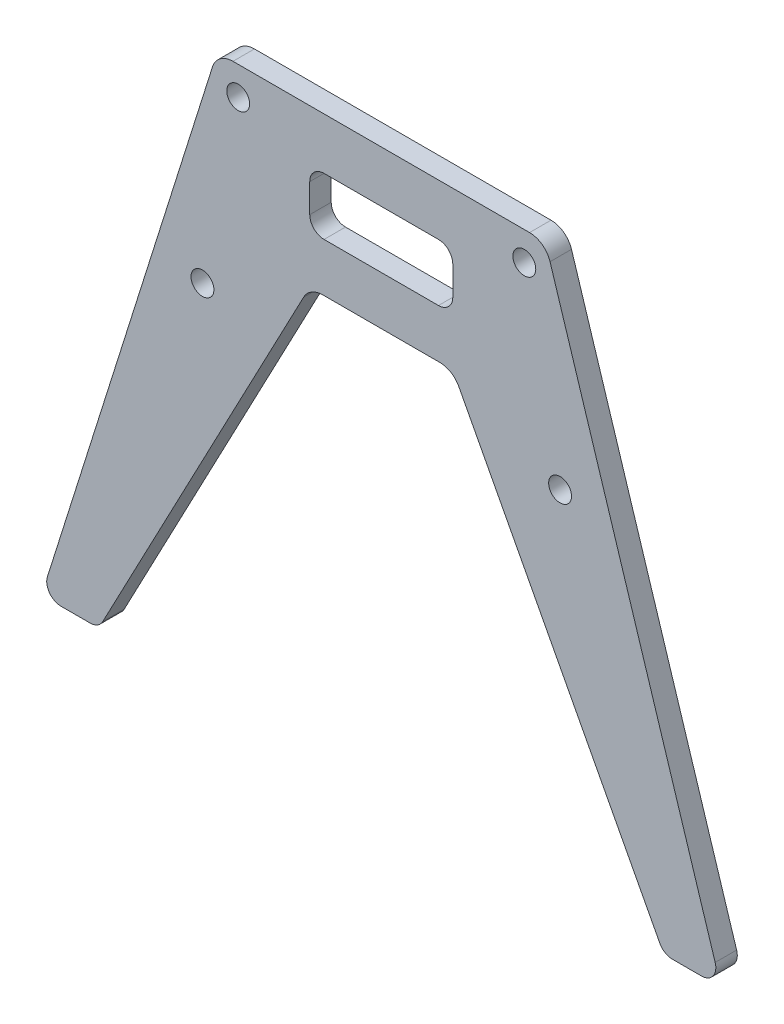
from build123d import *

# Parameters (mm, degrees)
SKETCH_2_R          = 1.6
EXTRUDE_1_DEPTH     = 3
FILLET_1_R          = 3
FILLET_2_R          = 2
FILLET_3_R          = 3
SKETCH_4_W          = 20
SKETCH_4_H          = 8
CUT_EXTRUDE_2_DEPTH = 77.136305652
FILLET_5_R          = 2
SKETCH_5_R          = 1.6
CUT_EXTRUDE_3_DEPTH = 77.136305652


with BuildPart() as part:
    # 草图2 → 凸台-拉伸1 (new body)
    with BuildSketch(Plane.XY):
        Polygon((-22.933897075, 18), (-47.5, -60), (-39.5, -60), (-10, -4), (10, -4), (39.5, -60), (47.5, -60), (22.933897075, 18), align=None)
        with Locations((-20, 14)):
            Circle(SKETCH_2_R, mode=Mode.SUBTRACT)
        with Locations((20, 14)):
            Circle(SKETCH_2_R, mode=Mode.SUBTRACT)
    extrude(amount=EXTRUDE_1_DEPTH)

    # 圆角1
    fillet_1_edges = [part.edges().sort_by_distance(p)[0] for p in [
        (22.933897075, 18, 1.5),
        (-22.933897075, 18, 1.5),
    ]]
    fillet(fillet_1_edges, radius=FILLET_1_R)

    # 圆角2
    fillet_2_edges = [part.edges().sort_by_distance(p)[0] for p in [
        (47.5, -60, 1.5),
        (39.5, -60, 1.5),
        (-39.5, -60, 1.5),
        (-47.5, -60, 1.5),
    ]]
    fillet(fillet_2_edges, radius=FILLET_2_R)

    # 圆角3
    fillet_3_edges = [part.edges().sort_by_distance(p)[0] for p in [
        (10, -4, 1.5),
        (-10, -4, 1.5),
    ]]
    fillet(fillet_3_edges, radius=FILLET_3_R)

    # 草图4 → 切除-拉伸2 (cut, through all)
    with BuildSketch(Plane.XY.offset(3)):
        with Locations((0, 6.8)):
            Rectangle(SKETCH_4_W, SKETCH_4_H)
    extrude(amount=-CUT_EXTRUDE_2_DEPTH, mode=Mode.SUBTRACT)

    # 圆角5
    fillet_5_edges = [part.edges().sort_by_distance(p)[0] for p in [
        (-10, 2.8, 1.5),
        (-10, 10.8, 1.5),
        (10, 10.8, 1.5),
        (10, 2.8, 1.5),
    ]]
    fillet(fillet_5_edges, radius=FILLET_5_R)

    # 草图5 → 切除-拉伸3 (cut, through all)
    with BuildSketch(Plane.XY.offset(3)):
        with Locations((-25, -11)):
            Circle(SKETCH_5_R)
        with Locations((25, -11)):
            Circle(SKETCH_5_R)
    extrude(amount=-CUT_EXTRUDE_3_DEPTH, mode=Mode.SUBTRACT)


solid = part.part
